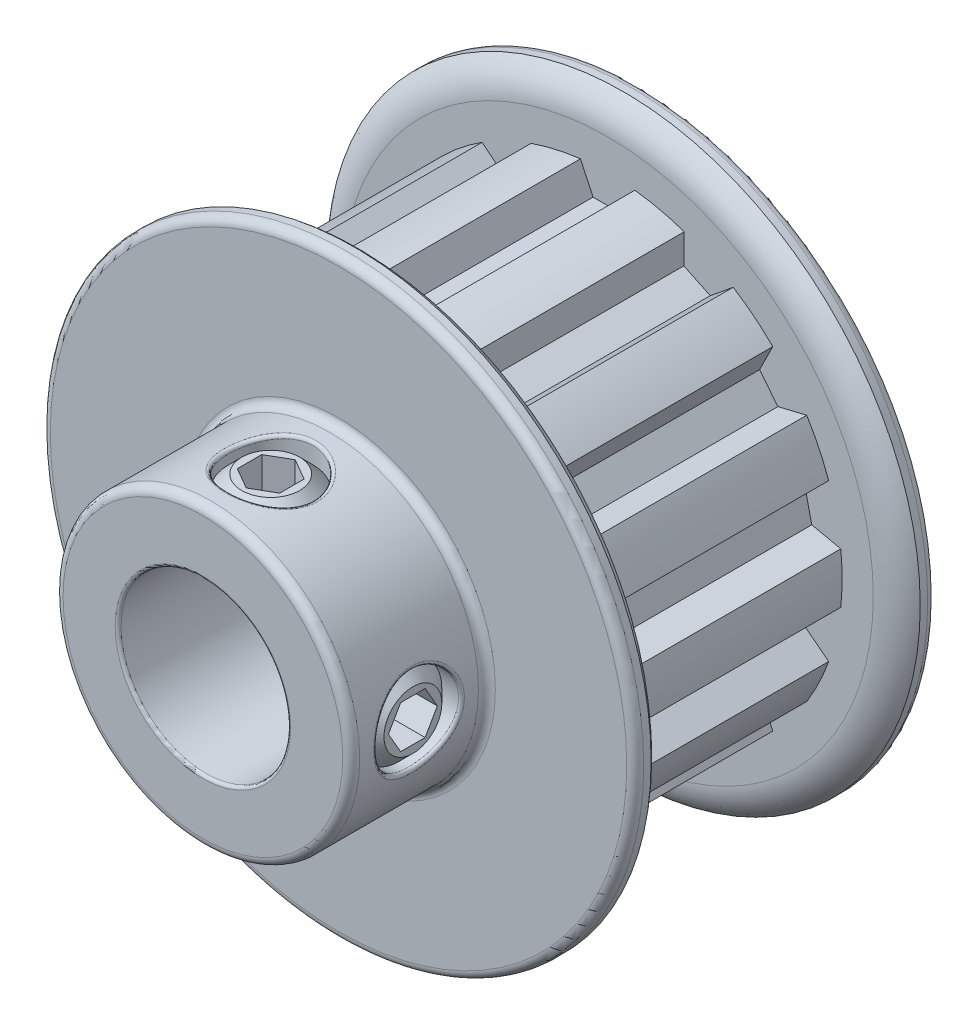
from build123d import *

# Parameters (mm, degrees)
CUT_EXTRUDE1_START = -8.8
CUT_EXTRUDE1_DEPTH = 11.2
CIRPATTERN1_COUNT  = 14
SKETCH4_R          = 2
CUT_EXTRUDE2_DEPTH = 23.317930012
CUT_EXTRUDE3_DEPTH = 1.5
CIRPATTERN2_COUNT  = 2
CIRPATTERN2_ANGLE  = 90
FILLET1_R          = 0.4
FILLET2_R          = 0.14


with BuildPart() as part:
    # Sketch7 → Revolve1 (revolve)
    with BuildSketch(Plane(origin=(0, 0, 0), x_dir=(0, 0, -1), z_dir=(1, 0, 0)), mode=Mode.PRIVATE) as revolve1_sk:
        with BuildLine():
            Line((-10.3, 4), (-10.3, 7))
            Line((-10.3, 7), (-3.9, 7))
            Line((-3.9, 7), (-3.9, 14))
            Line((-3.9, 14), (-3.15, 14))
            ThreePointArc((-3.15, 14), (-2.598364656, 13.356481599), (-2.4, 12.5324252))
            Line((-2.4, 12.5324252), (-2.4, 11.064850399))
            Line((-2.4, 11.064850399), (8.8, 11.064850399))
            Line((8.8, 11.064850399), (8.8, 12.5324252))
            ThreePointArc((8.8, 12.5324252), (8.998364656, 13.356481599), (9.55, 14))
            Line((9.55, 14), (10.3, 14))
            Line((10.3, 14), (10.3, 4))
            Line((10.3, 4), (-10.3, 4))
        make_face()
    revolve(revolve1_sk.sketch.rotate(Axis((0, 0, 10.3), (0, 0, -1)), 90), axis=Axis((0, 0, 10.3), (0, 0, -1)))

    # Sketch3 → Cut-Extrude1 (cut)
    with BuildSketch(Plane.XY.offset(CUT_EXTRUDE1_START)):
        with BuildLine():
            Line((-0.690489274, 9.72025), (0.690489274, 9.72025))
            Line((0.690489274, 9.72025), (1.2827, 10.99025))
            ThreePointArc((1.2827, 10.99025), (0, 11.064850399), (-1.2827, 10.99025))
            Line((-1.2827, 10.99025), (-0.690489274, 9.72025))
        make_face()
    cut_extrude1 = extrude(amount=CUT_EXTRUDE1_DEPTH, mode=Mode.SUBTRACT)

    # CirPattern1: Cut-Extrude1 ×14 about axis
    cirpattern1_axis = Axis((0, 0, 0), (0, 0, 1))
    for i in range(1, CIRPATTERN1_COUNT):
        add(cut_extrude1.rotate(cirpattern1_axis, i * 360 / CIRPATTERN1_COUNT), mode=Mode.SUBTRACT)

    # Sketch4 → Cut-Extrude2 (cut, through all)
    with BuildSketch(Plane(origin=(0, 0, 0), x_dir=(1, 0, 0), z_dir=(0, 1, 0))):
        with Locations(Location((0, -7.1, 0), (0, 0, 90))):
            Circle(SKETCH4_R)
    cut_extrude2 = extrude(amount=CUT_EXTRUDE2_DEPTH, mode=Mode.SUBTRACT)

    # Sketch5 → Revolve2 (revolve)
    with BuildSketch(Plane.XY.offset(7.1), mode=Mode.PRIVATE) as revolve2_sk:
        Polygon((0, 6.708203932), (0, 4), (-1.365, 4), (-2, 4.635), (-2, 6.073203932), (-1.365, 6.708203932), align=None)
    revolve2 = revolve(revolve2_sk.sketch.rotate(Axis((0, 0, 7.1), (0, 1, 0)), 270), axis=Axis((0, 0, 7.1), (0, 1, 0)))

    # Sketch6 → Cut-Extrude3 (cut)
    with BuildSketch(Plane(origin=(0, 6.708203932, 0), x_dir=(-1, 0, 0), z_dir=(0, -1, 0))):
        Polygon((0, -5.945299462), (-1, -6.522649731), (-1, -7.677350269), (0, -8.254700538), (1, -7.677350269), (1, -6.522649731), align=None)
    cut_extrude3 = extrude(amount=CUT_EXTRUDE3_DEPTH, mode=Mode.SUBTRACT)

    # CirPattern2: Cut-Extrude2, Revolve2, Cut-Extrude3 ×2 about axis
    cirpattern2_axis = Axis((0, 0, 0), (0, 0, -1))
    add([cut_extrude2.rotate(cirpattern2_axis, i * CIRPATTERN2_ANGLE / (CIRPATTERN2_COUNT - 1)) for i in range(1, CIRPATTERN2_COUNT)], mode=Mode.SUBTRACT)
    add([revolve2.rotate(cirpattern2_axis, i * CIRPATTERN2_ANGLE / (CIRPATTERN2_COUNT - 1)) for i in range(1, CIRPATTERN2_COUNT)])
    add([cut_extrude3.rotate(cirpattern2_axis, i * CIRPATTERN2_ANGLE / (CIRPATTERN2_COUNT - 1)) for i in range(1, CIRPATTERN2_COUNT)], mode=Mode.SUBTRACT)

    # Fillet1
    fillet1_edges = [part.edges().sort_by_distance(p)[0] for p in [
        (-14, 0, -10.3),
        (-7, 0, 10.3),
        (-7, 0, 3.9),
        (-14, 0, 3.9),
    ]]
    fillet(fillet1_edges, radius=FILLET1_R)

    # Fillet2
    fillet2_edges = [part.edges().sort_by_distance(p)[0] for p in [
        (-4, 0, -10.3),
        (-1e-09, 6.999999991, 9.100000016),
        (6.708203932, -2, 7.1),
        (-4, 0, 10.3),
    ]]
    fillet(fillet2_edges, radius=FILLET2_R)


solid = part.part
